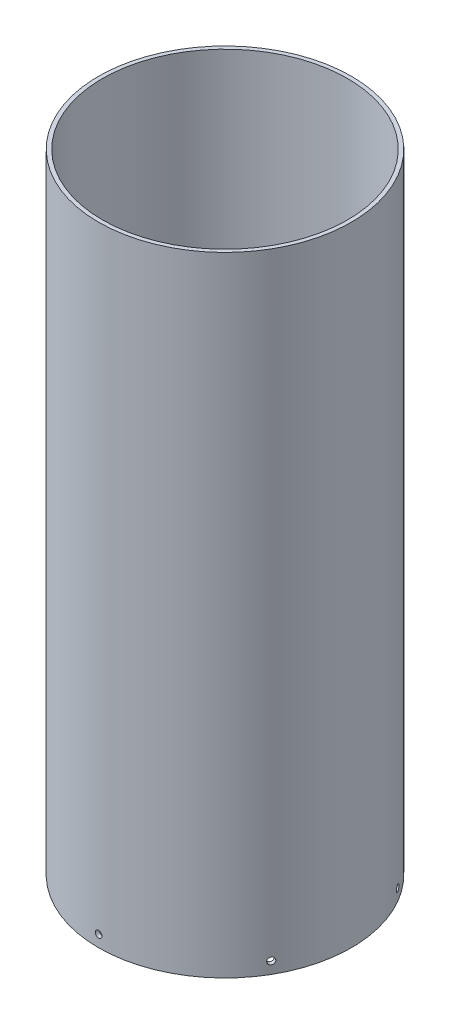
from build123d import *

# Parameters (mm, degrees)
SKETCH1_R           = 51.1048
SKETCH1_R_2         = 49.53
BOSS_EXTRUDE1_DEPTH = 254
SKETCH2_R           = 1.35255
CUT_EXTRUDE1_DEPTH  = 265.082186385
CIRPATTERN1_COUNT   = 6


with BuildPart() as part:
    # Sketch1 → Boss-Extrude1 (new body)
    with BuildSketch(Plane(origin=(0, 0, 0), x_dir=(1, 0, 0), z_dir=(0, 1, 0))):
        with Locations(Location((0, 0, 0), (0, 0, 270))):
            Circle(SKETCH1_R)
        with Locations(Location((0, 0, 0), (0, 0, 270))):
            Circle(SKETCH1_R_2, mode=Mode.SUBTRACT)
    extrude(amount=BOSS_EXTRUDE1_DEPTH)

    # Sketch2 → Cut-Extrude1 (cut, through all)
    with BuildSketch(Plane.XY):
        with Locations(Location((0, 4.7625, 0), (0, 0, 90))):
            Circle(SKETCH2_R)
    cut_extrude1 = extrude(amount=-CUT_EXTRUDE1_DEPTH, mode=Mode.SUBTRACT)

    # CirPattern1: Cut-Extrude1 ×6 about axis
    cirpattern1_axis = Axis((0, 254, 0), (0, -1, 0))
    for i in range(1, CIRPATTERN1_COUNT):
        add(cut_extrude1.rotate(cirpattern1_axis, i * 360 / CIRPATTERN1_COUNT), mode=Mode.SUBTRACT)


solid = part.part
